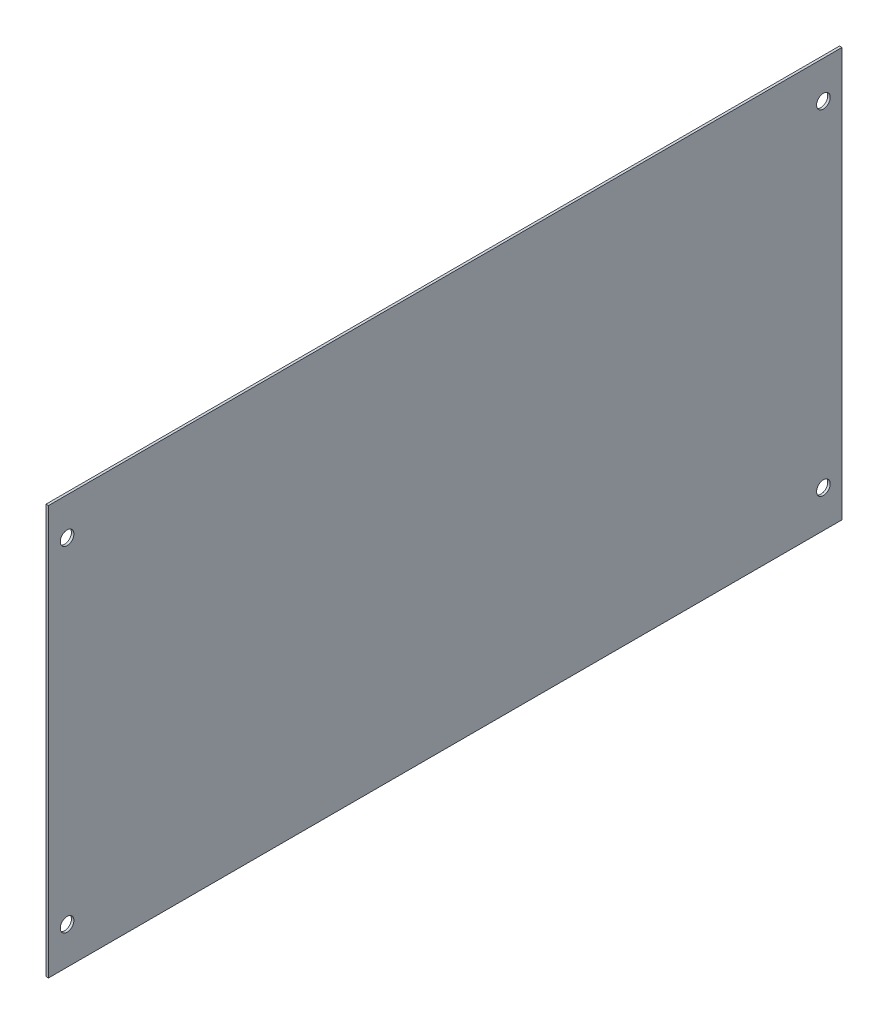
from build123d import *

# Parameters (mm, degrees)
SKETCH1_W   = 640
SKETCH1_H   = 330
SKETCH1_R   = 5.5
THICKEN1_T1 = 2


with BuildPart() as body_1:
    # Sketch1 → Surface-Plane1: a flat surface bounded by the sketch
    with BuildSketch(Plane(origin=(0, 0, 0), x_dir=(0, 0, -1), z_dir=(1, 0, 0)), mode=Mode.PRIVATE) as surface_plane1_1_region:
        Rectangle(SKETCH1_W, SKETCH1_H)
        with Locations((-305, 135)):
            Circle(SKETCH1_R, mode=Mode.SUBTRACT)
        with Locations((305, 135)):
            Circle(SKETCH1_R, mode=Mode.SUBTRACT)
        with Locations((305, -135)):
            Circle(SKETCH1_R, mode=Mode.SUBTRACT)
        with Locations((-305, -135)):
            Circle(SKETCH1_R, mode=Mode.SUBTRACT)
    surface_plane1_1 = surface_plane1_1_region.sketch.faces()[0]
    add(Solid.thicken(surface_plane1_1, THICKEN1_T1))


solid = body_1.part
